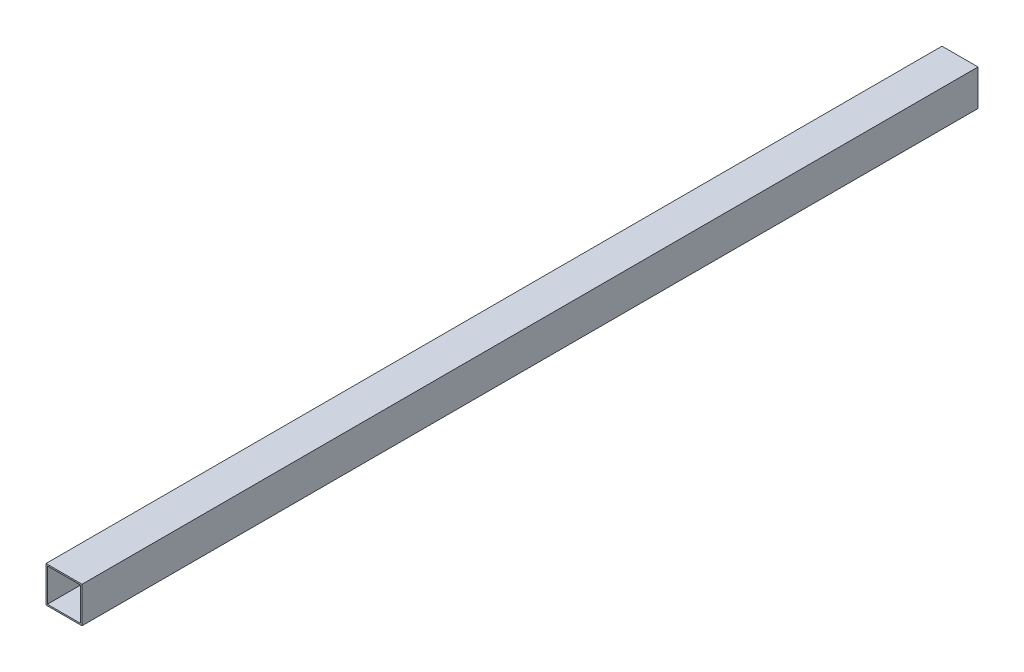
from build123d import *

# Parameters (mm, degrees)
SKETCH1_W           = 13
SKETCH1_H           = 13
SKETCH1_W_2         = 12
SKETCH1_H_2         = 12
BOSS_EXTRUDE1_DEPTH = 323.5


with BuildPart() as part:
    # Sketch1 → Boss-Extrude1 (new body)
    with BuildSketch(Plane.XY):
        Rectangle(SKETCH1_W, SKETCH1_H)
        Rectangle(SKETCH1_W_2, SKETCH1_H_2, mode=Mode.SUBTRACT)
    extrude(amount=BOSS_EXTRUDE1_DEPTH)


solid = part.part
